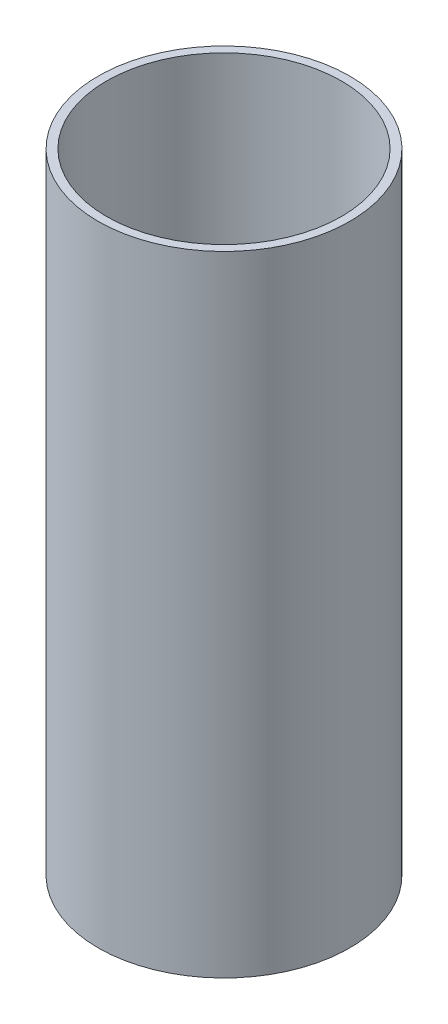
from build123d import *

# Parameters (mm, degrees)
SKETCH1_R           = 30
SKETCH1_R_2         = 28
BOSS_EXTRUDE1_DEPTH = 150


with BuildPart() as part:
    # Sketch1 → Boss-Extrude1 (new body)
    with BuildSketch(Plane(origin=(0, 0, 0), x_dir=(1, 0, 0), z_dir=(0, 1, 0))):
        with Locations(Location((0, 0, 0), (0, 0, 270))):
            Circle(SKETCH1_R)
        with Locations(Location((0, 0, 0), (0, 0, 270))):
            Circle(SKETCH1_R_2, mode=Mode.SUBTRACT)
    extrude(amount=BOSS_EXTRUDE1_DEPTH)


solid = part.part
